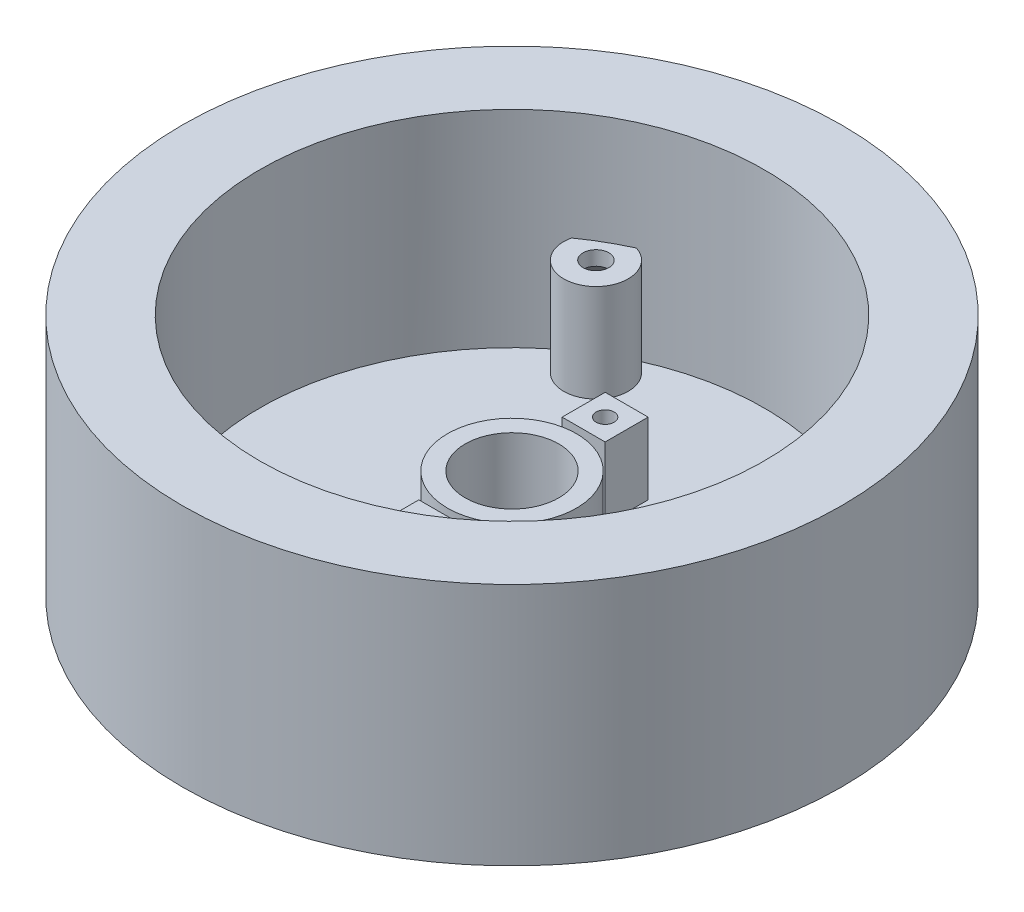
from build123d import *

# Parameters (mm, degrees)
SKETCH1_R                                    = 23
BOSS_EXTRUDE1_DEPTH                          = 17
SHELL1_T                                     = -2.6
SKETCH4_R                                    = 4.5
BOSS_EXTRUDE3_DEPTH                          = 5
SKETCH5_R                                    = 3.265
CUT_EXTRUDE2_DEPTH                           = 34.857938508
M1_6_TAPPED_HOLE1_D                          = 1.25
BOSS_EXTRUDE8_START                          = 5
SKETCH20_W                                   = 3
SKETCH20_H                                   = 3
SKETCH20_R                                   = 0.625
BOSS_EXTRUDE8_DEPTH                          = 5
SKETCH22_R                                   = 20.4
SKETCH22_R_2                                 = 17.6
BOSS_EXTRUDE10_DEPTH                         = 14.4
SKETCH24_R                                   = 2.25
BOSS_EXTRUDE11_DEPTH                         = 6.8
CSK_SLOT_FOR_M1_6_COUNTERSUNK_FLAT_H_2_COUNT = 2
CSK_SLOT_FOR_M1_6_COUNTERSUNK_FLAT_H_2_PITCH = 27.712812921
CSK_SLOT_FOR_M1_6_COUNTERSUNK_FLAT_H_3_COUNT = 2
CSK_SLOT_FOR_M1_6_COUNTERSUNK_FLAT_H_3_PITCH = 27.712812921


with BuildPart() as part:
    # Sketch1 → Boss-Extrude1 (new body)
    with BuildSketch(Plane(origin=(0, 0, 0), x_dir=(1, 0, 0), z_dir=(0, 1, 0))):
        with Locations(Location((0, 0, 0), (0, 0, 270))):
            Circle(SKETCH1_R)
    extrude(amount=BOSS_EXTRUDE1_DEPTH)

    # Shell1
    shell1_openings = [part.faces().sort_by_distance(p)[0] for p in [
        (0, 17, 0),
    ]]
    offset(amount=SHELL1_T, openings=shell1_openings, kind=Kind.INTERSECTION)

    # Sketch4 → Boss-Extrude3 (add)
    with BuildSketch(Plane(origin=(0, 2.6, 0), x_dir=(1, 0, 0), z_dir=(0, 1, 0))):
        with Locations(Location((0, 0, 0), (0, 0, 270))):
            Circle(SKETCH4_R)
    extrude(amount=BOSS_EXTRUDE3_DEPTH)

    # Sketch5 → Cut-Extrude2 (cut, through all)
    with BuildSketch(Plane(origin=(0, 7.6, 0), x_dir=(1, 0, 0), z_dir=(0, 1, 0))):
        with Locations(Location((0, 0, 0), (0, 0, 270))):
            Circle(SKETCH5_R)
    extrude(amount=-CUT_EXTRUDE2_DEPTH, mode=Mode.SUBTRACT)

    # M1.6 Tapped Hole1 (through all)
    with Locations(Plane(origin=(0, 0, 0), x_dir=(-1, 0, 0), z_dir=(0, -1, 0))):
        with Locations((0, 6.497951731), (0, -6.497951731)):
            Hole(M1_6_TAPPED_HOLE1_D / 2)

    # Sketch20 → Boss-Extrude8 (add)
    # profile 1 of 2: a face of its own
    with BuildSketch(Plane(origin=(0, 2.6, 0), x_dir=(1, 0, 0), z_dir=(0, 1, 0)).offset(BOSS_EXTRUDE8_START)):
        with Locations((0, -6.497951731)):
            Rectangle(SKETCH20_W, SKETCH20_H)
        with Locations(Location((0, -6.497951731, 0), (0, 0, 90))):
            Circle(SKETCH20_R, mode=Mode.SUBTRACT)
    # profile 2 of 2: a face of its own
    with BuildSketch(Plane(origin=(0, 2.6, 0), x_dir=(1, 0, 0), z_dir=(0, 1, 0)).offset(BOSS_EXTRUDE8_START)):
        with Locations((0, 6.497951731)):
            Rectangle(SKETCH20_W, SKETCH20_H)
        with Locations(Location((0, 6.497951731, 0), (0, 0, 90))):
            Circle(SKETCH20_R, mode=Mode.SUBTRACT)
    extrude(amount=-BOSS_EXTRUDE8_DEPTH)

    # Sketch22 → Boss-Extrude10 (add)
    with BuildSketch(Plane(origin=(0, 2.6, 0), x_dir=(1, 0, 0), z_dir=(0, 1, 0))):
        Circle(SKETCH22_R)
        with Locations(Location((0, 0, 0), (0, 0, 270))):
            Circle(SKETCH22_R_2, mode=Mode.SUBTRACT)
    extrude(amount=BOSS_EXTRUDE10_DEPTH)

    # Sketch24 → Boss-Extrude11 (add)
    with BuildSketch(Plane(origin=(0, 2.6, 0), x_dir=(1, 0, 0), z_dir=(0, 1, 0))):
        with Locations((-8, 13.856406461)):
            Circle(SKETCH24_R)
        with Locations((16, 0)):
            Circle(SKETCH24_R)
        with Locations((-8, -13.856406461)):
            Circle(SKETCH24_R)
    extrude(amount=BOSS_EXTRUDE11_DEPTH)

    # Sketch26 → CSK SLOT for M1.6 Countersunk Flat Head (revolve, cut)
    with BuildSketch(Plane(origin=(-8, 0, 13.856406461), x_dir=(0, 0, -1), z_dir=(1, 0, 0))):
        Polygon((0, 0), (0, 17), (0.9, 17), (0.9, 8.4), (1.8, 7.5), (1.8, 0), align=None)
    csk_slot_for_m1_6_countersunk_flat_head = revolve(axis=Axis((-8, -6.35, 13.856406461), (0, 1, 0)), mode=Mode.SUBTRACT)

    # CSK SLOT for M1.6 Countersunk Flat H 2: CSK SLOT for M1.6 Countersunk Flat Head ×2
    with Locations(*[(0, 0, -i * CSK_SLOT_FOR_M1_6_COUNTERSUNK_FLAT_H_2_PITCH) for i in range(1, CSK_SLOT_FOR_M1_6_COUNTERSUNK_FLAT_H_2_COUNT)]):
        add(csk_slot_for_m1_6_countersunk_flat_head, mode=Mode.SUBTRACT)

    # CSK SLOT for M1.6 Countersunk Flat H 3: CSK SLOT for M1.6 Countersunk Flat Head ×2
    with Locations(*[Vector(0.8660254037844364, 0, -0.5000000000000041) * (i * CSK_SLOT_FOR_M1_6_COUNTERSUNK_FLAT_H_3_PITCH) for i in range(1, CSK_SLOT_FOR_M1_6_COUNTERSUNK_FLAT_H_3_COUNT)]):
        add(csk_slot_for_m1_6_countersunk_flat_head, mode=Mode.SUBTRACT)


solid = part.part
